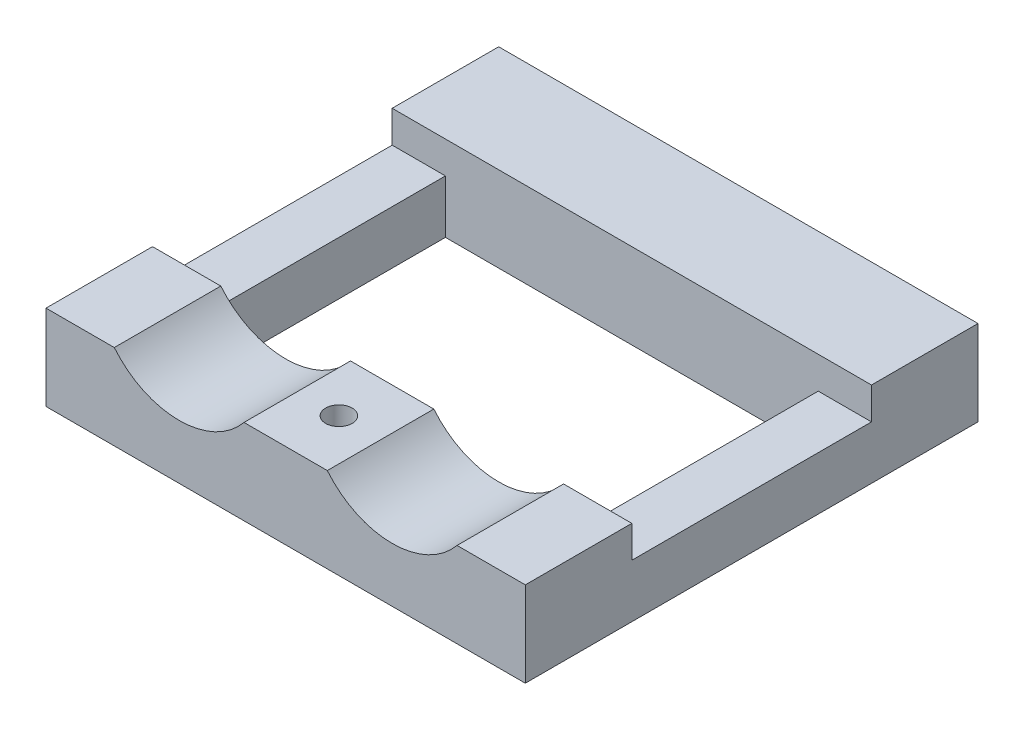
from build123d import *

# Parameters (mm, degrees)
SKETCH4_W           = 57.15
SKETCH4_H           = 10.16
BOSS_EXTRUDE1_DEPTH = 12.7
SKETCH5_R           = 10
CUT_EXTRUDE1_DEPTH  = 60.419172832
SKETCH8_R           = 1.5875
CUT_EXTRUDE3_DEPTH  = 60.419172832
SKETCH9_W           = 6.35
SKETCH9_H           = 6.35
BOSS_EXTRUDE2_DEPTH = 28.575
SKETCH11_W          = 57.15
SKETCH11_H          = 10.16
BOSS_EXTRUDE3_DEPTH = 12.7


with BuildPart() as part:
    # Sketch4 → Boss-Extrude1 (new body)
    with BuildSketch(Plane.XY):
        with Locations((28.575, 5.08)):
            Rectangle(SKETCH4_W, SKETCH4_H)
    extrude(amount=BOSS_EXTRUDE1_DEPTH)

    # Sketch5 → Cut-Extrude1 (cut, through all)
    with BuildSketch(Plane.XY.offset(12.7)):
        with Locations((15.875, 16.5)):
            Circle(SKETCH5_R)
        with Locations((41.275, 16.5)):
            Circle(SKETCH5_R)
    extrude(amount=-CUT_EXTRUDE1_DEPTH, mode=Mode.SUBTRACT)

    # Sketch8 → Cut-Extrude3 (cut, through all)
    with BuildSketch(Plane(origin=(0, 10.16, 0), x_dir=(1, 0, 0), z_dir=(0, 1, 0))):
        with Locations(Location((28.575, -6.35, 0), (0, 0, 270))):
            Circle(SKETCH8_R)
    extrude(amount=-CUT_EXTRUDE3_DEPTH, mode=Mode.SUBTRACT)

    # Sketch9 → Boss-Extrude2 (add)
    with BuildSketch(Plane(origin=(0, 0, 0), x_dir=(-1, 0, 0), z_dir=(0, 0, -1))):
        with Locations((-53.975, 3.175)):
            Rectangle(SKETCH9_W, SKETCH9_H)
        with Locations((-3.175, 3.175)):
            Rectangle(SKETCH9_W, SKETCH9_H)
    extrude(amount=BOSS_EXTRUDE2_DEPTH)

    # Sketch11 → Boss-Extrude3 (add)
    with BuildSketch(Plane(origin=(0, 0, -28.575), x_dir=(-1, 0, 0), z_dir=(0, 0, -1))):
        with Locations((-28.575, 5.08)):
            Rectangle(SKETCH11_W, SKETCH11_H)
    extrude(amount=BOSS_EXTRUDE3_DEPTH)


solid = part.part
